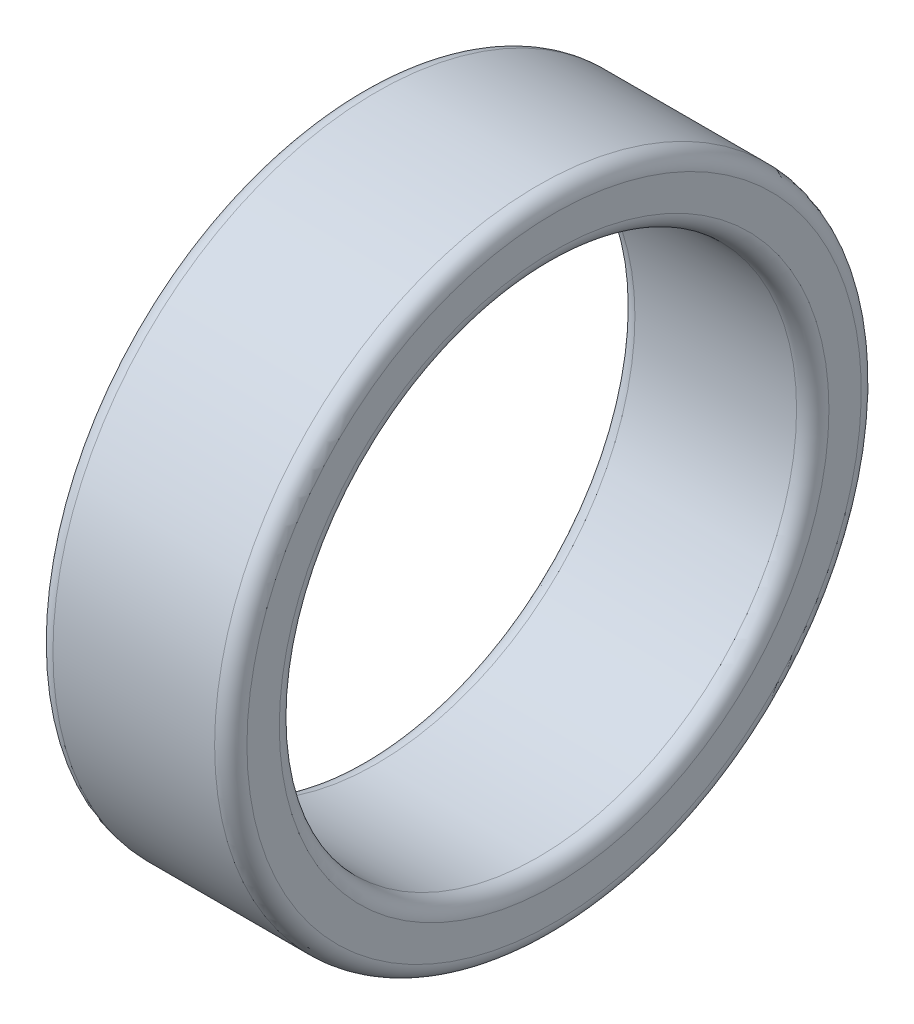
from build123d import *


with BuildPart() as part:
    # Croquis1 → Revolución1 (revolve)
    with BuildSketch(Plane(origin=(0, 0, 0), x_dir=(1, 0, 0), z_dir=(0, 1, 0)), mode=Mode.PRIVATE) as revoluci_n1_sk:
        with BuildLine():
            Line((1.5, 4.25), (1.5, 4.75))
            ThreePointArc((1.5, 4.75), (1.426776695, 4.926776695), (1.25, 5))
            Line((1.25, 5), (-1.25, 5))
            ThreePointArc((-1.25, 5), (-1.426776695, 4.926776695), (-1.5, 4.75))
            Line((-1.5, 4.75), (-1.5, 4.25))
            ThreePointArc((-1.5, 4.25), (-1.426776695, 4.073223305), (-1.25, 4))
            Line((-1.25, 4), (1.25, 4))
            ThreePointArc((1.25, 4), (1.426776695, 4.073223305), (1.5, 4.25))
        make_face()
    revolve(revoluci_n1_sk.sketch.rotate(Axis((0, 0, 0), (1, 0, 0)), 180), axis=Axis((0, 0, 0), (1, 0, 0)))


solid = part.part
